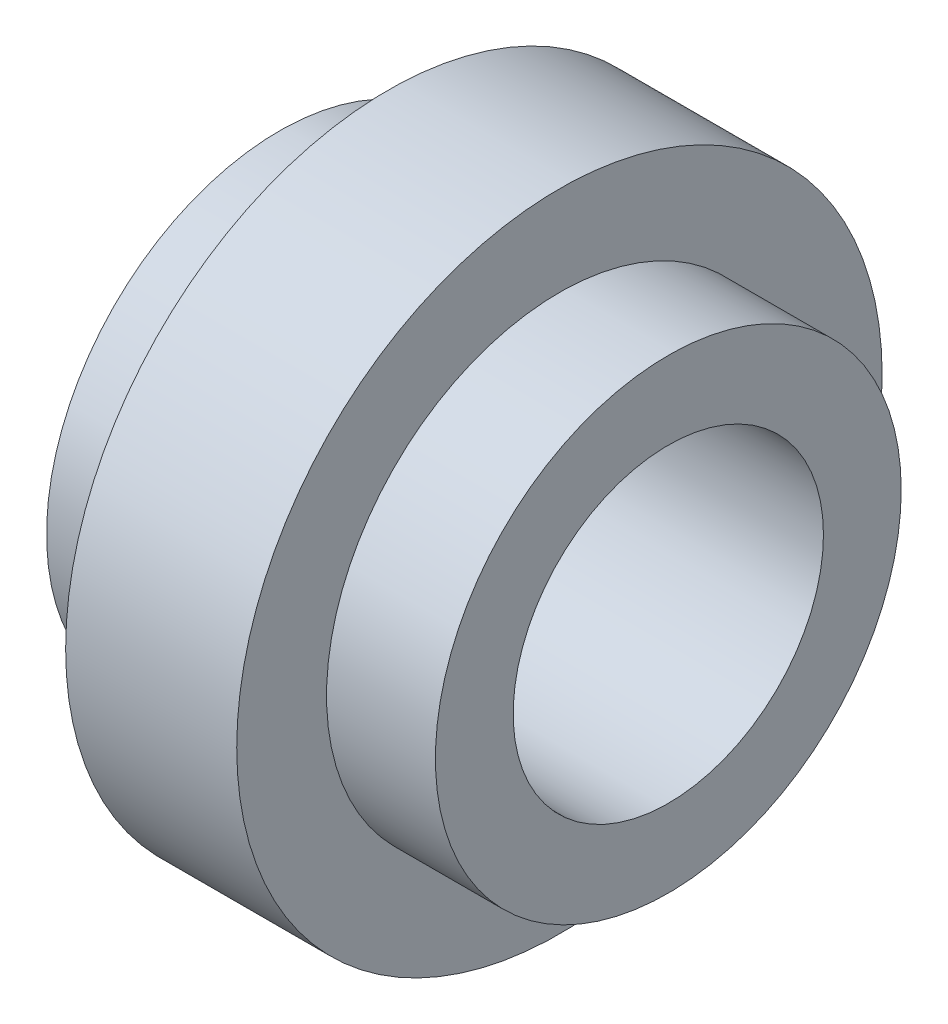
from build123d import *

# Parameters (mm, degrees)
SKETCH1_R                = 14.975
SKETCH1_R_2              = 9.975
BOSS_EXTRUDE1_DEPTH      = 25
BOSS_EXTRUDE2_DEPTH      = 5.5
BOSS_EXTRUDE2_DEPTH_BACK = 5.5
SKETCH2_R                = 20.75
SKETCH2_R_2              = 9.975


with BuildPart() as part:
    # Sketch1 → Boss-Extrude1 (new body)
    with BuildSketch(Plane(origin=(0, 0, 0), x_dir=(0, 0, -1), z_dir=(1, 0, 0))):
        Circle(SKETCH1_R)
        Circle(SKETCH1_R_2, mode=Mode.SUBTRACT)
    extrude(amount=BOSS_EXTRUDE1_DEPTH)

    # Sketch2 → Boss-Extrude2 (add, two sides: drawn at the far end of the back side and taken through both)
    with BuildSketch(Plane(origin=(12.5, 0, 0), x_dir=(0, 0, -1), z_dir=(1, 0, 0)).offset(-BOSS_EXTRUDE2_DEPTH_BACK)):
        Circle(SKETCH2_R)
        Circle(SKETCH2_R_2, mode=Mode.SUBTRACT)
    extrude(amount=BOSS_EXTRUDE2_DEPTH + BOSS_EXTRUDE2_DEPTH_BACK)


solid = part.part
